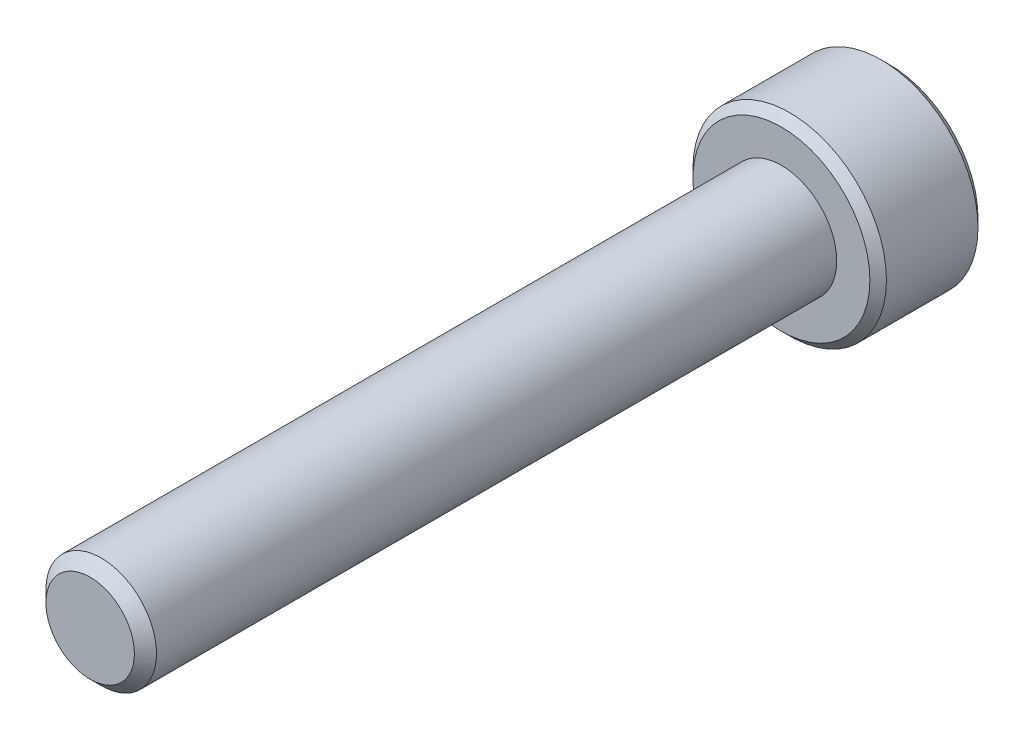
from build123d import *

# Parameters (mm, degrees)
SKETCH_1_R          = 3.5
EXTRUDE_1_DEPTH     = 3.91
SKETCH_2_R          = 2
EXTRUDE_2_DEPTH     = 25
CUT_EXTRUDE_1_DEPTH = 2
CHAMFER_1_SIZE      = 0.4
CHAMFER_2_SIZE      = 0.3


with BuildPart() as part:
    # 草图1 → 凸台-拉伸1 (new body)
    with BuildSketch(Plane.XY):
        Circle(SKETCH_1_R)
    extrude(amount=EXTRUDE_1_DEPTH)

    # 草图2 → 凸台-拉伸2 (add)
    with BuildSketch(Plane.XY.offset(3.91)):
        Circle(SKETCH_2_R)
    extrude(amount=EXTRUDE_2_DEPTH)

    # 草图3 → 切除-拉伸1 (cut)
    with BuildSketch(Plane(origin=(0, 0, 0), x_dir=(-1, 0, 0), z_dir=(0, 0, -1))):
        Polygon((0, 1.760918321), (-1.525, 0.880459161), (-1.525, -0.880459161), (0, -1.760918321), (1.525, -0.880459161), (1.525, 0.880459161), align=None)
    extrude(amount=-CUT_EXTRUDE_1_DEPTH, mode=Mode.SUBTRACT)

    # 倒角1
    chamfer_1_edges = [part.edges().sort_by_distance(p)[0] for p in [
        (-2, 0, 28.91),
    ]]
    chamfer(chamfer_1_edges, length=CHAMFER_1_SIZE)

    # 倒角2
    chamfer_2_edges = [part.edges().sort_by_distance(p)[0] for p in [
        (-3.5, 0, 0),
        (-3.5, 0, 3.91),
    ]]
    chamfer(chamfer_2_edges, length=CHAMFER_2_SIZE)


solid = part.part
